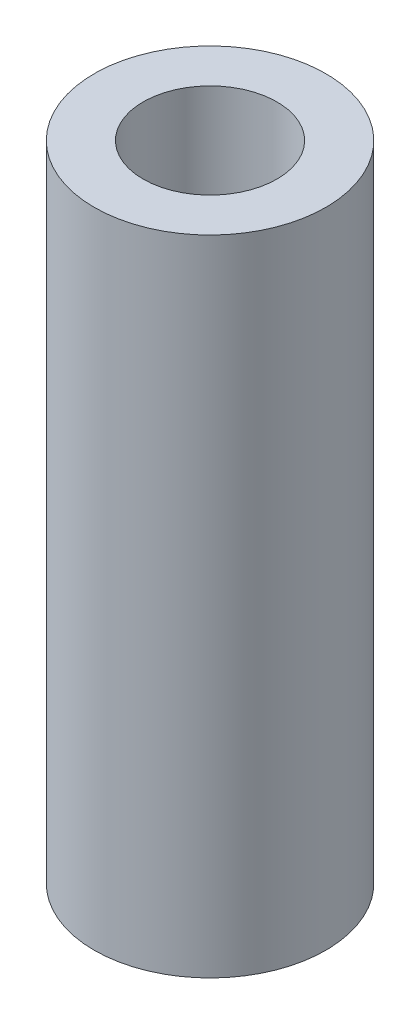
from build123d import *

# Parameters (mm, degrees)
SKETCH_1_R      = 4.5
SKETCH_1_R_2    = 2.6
EXTRUDE_1_DEPTH = 25


with BuildPart() as part:
    # 草图1 → 凸台-拉伸1 (new body)
    with BuildSketch(Plane(origin=(0, 0, 0), x_dir=(1, 0, 0), z_dir=(0, 1, 0))):
        with Locations(Location((0, 0, 0), (0, 0, 270))):
            Circle(SKETCH_1_R)
        with Locations(Location((0, 0, 0), (0, 0, 270))):
            Circle(SKETCH_1_R_2, mode=Mode.SUBTRACT)
    extrude(amount=EXTRUDE_1_DEPTH)


solid = part.part
